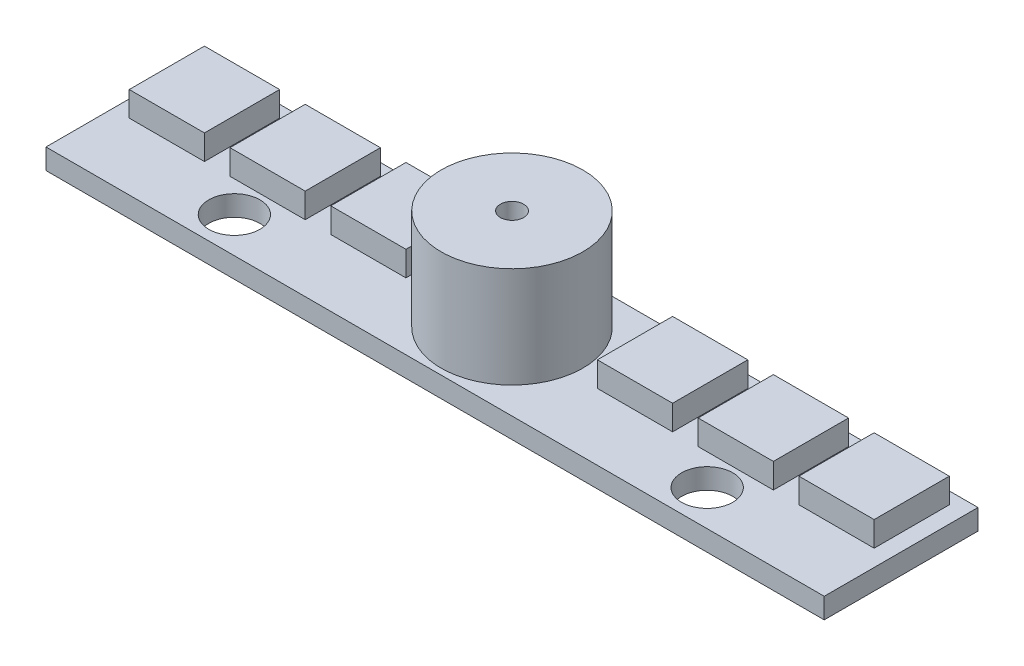
from build123d import *

# Parameters (mm, degrees)
SKETCH1_W           = 50.2
SKETCH1_H           = 9.92
SKETCH1_R           = 1.65
BOSS_EXTRUDE1_DEPTH = 1.32
SKETCH2_R           = 4.575
BOSS_EXTRUDE2_DEPTH = 6.5
SKETCH3_R           = 0.75
CUT_EXTRUDE1_DEPTH  = 1.5
SKETCH4_W           = 4.85
SKETCH4_H           = 4.85
BOSS_EXTRUDE3_DEPTH = 1.6


with BuildPart() as part:
    # Sketch1 → Boss-Extrude1 (new body)
    with BuildSketch(Plane(origin=(0, 0, 0), x_dir=(1, 0, 0), z_dir=(0, 1, 0))):
        Rectangle(SKETCH1_W, SKETCH1_H)
        with Locations(Location((-15.25, -2.66, 0), (0, 0, 270))):
            Circle(SKETCH1_R, mode=Mode.SUBTRACT)
        with Locations(Location((15.25, -2.66, 0), (0, 0, 90))):
            Circle(SKETCH1_R, mode=Mode.SUBTRACT)
    extrude(amount=BOSS_EXTRUDE1_DEPTH)

    # Sketch2 → Boss-Extrude2 (add)
    with BuildSketch(Plane(origin=(0, 1.32, 0), x_dir=(1, 0, 0), z_dir=(0, 1, 0))):
        with Locations(Location((0, 0, 0), (0, 0, 90))):
            Circle(SKETCH2_R)
    extrude(amount=BOSS_EXTRUDE2_DEPTH)

    # Sketch3 → Cut-Extrude1 (cut)
    with BuildSketch(Plane(origin=(0, 7.82, 0), x_dir=(1, 0, 0), z_dir=(0, 1, 0))):
        with Locations(Location((0, 0, 0), (0, 0, 270))):
            Circle(SKETCH3_R)
    extrude(amount=-CUT_EXTRUDE1_DEPTH, mode=Mode.SUBTRACT)

    # Sketch4 → Boss-Extrude3 (add)
    with BuildSketch(Plane(origin=(0, 1.32, 0), x_dir=(1, 0, 0), z_dir=(0, 1, 0))):
        with Locations((-8.6, 1.76)):
            Rectangle(SKETCH4_W, SKETCH4_H)
        with Locations((-15.1, 1.76)):
            Rectangle(SKETCH4_W, SKETCH4_H)
        with Locations((-21.6, 1.76)):
            Rectangle(SKETCH4_W, SKETCH4_H)
        with Locations((8.6, 1.76)):
            Rectangle(SKETCH4_W, SKETCH4_H)
        with Locations((15.1, 1.76)):
            Rectangle(SKETCH4_W, SKETCH4_H)
        with Locations((21.6, 1.76)):
            Rectangle(SKETCH4_W, SKETCH4_H)
    extrude(amount=BOSS_EXTRUDE3_DEPTH)


solid = part.part
